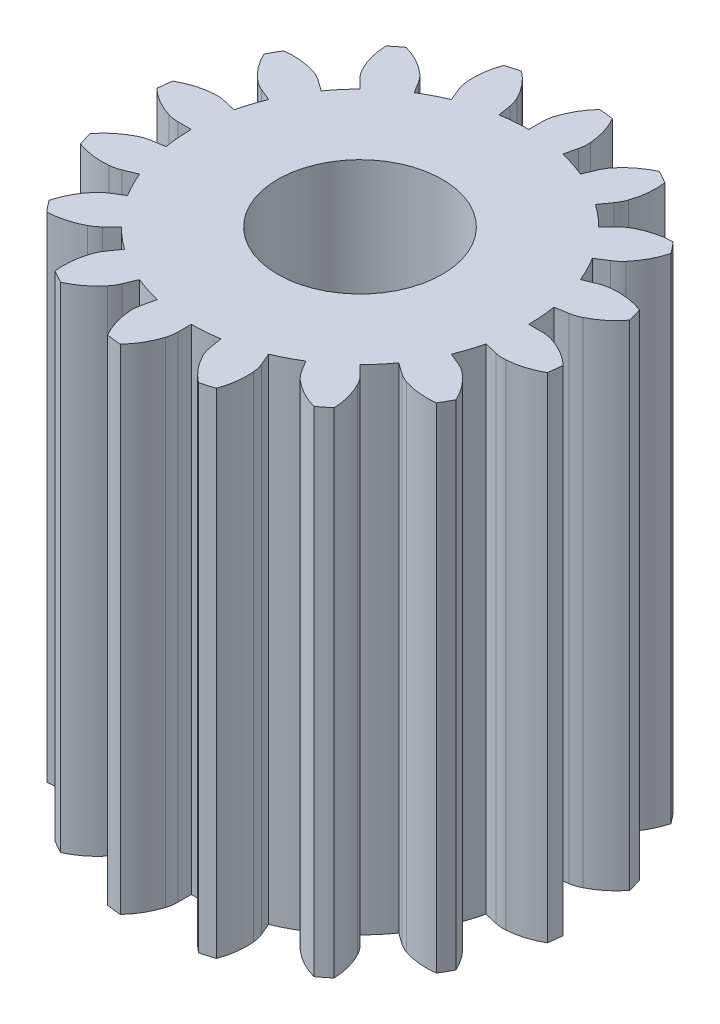
from build123d import *

# Parameters (mm, degrees)
RESSALTO_EXTRUS_O2_DEPTH = 6
PADR_OCIRCULAR1_COUNT    = 16
ESBO_O6_R                = 1
CORTE_EXTRUS_O2_DEPTH    = 6


with BuildPart() as part:
    # Esboço5 → Ressalto-extrusão2 (new body)
    with BuildSketch(Plane(origin=(0, 0, 0), x_dir=(1, 0, 0), z_dir=(0, 1, 0))):
        with BuildLine():
            ThreePointArc((0.513081642, 2.284755025), (0.476160184, 2.484429594), (0.395663043, 2.670852066))
            ThreePointArc((0.395663043, 2.670852066), (0.308851182, 2.682277194), (0.221714504, 2.690881394))
            ThreePointArc((0.221714504, 2.690881394), (0.10095443, 2.527632713), (0.019617773, 2.341574991))
            ThreePointArc((0.019617773, 2.341574991), (0.004932086, 2.277352206), (0, 2.211656619))
            Line((0, 2.211656619), (0, 2.05))
            ThreePointArc((0, 2.05), (-0.23449812, -2.036543796), (0.465917747, 1.996351836))
            Line((0.465917747, 1.996351836), (0.50265857, 2.153777928))
            ThreePointArc((0.50265857, 2.153777928), (0.512786649, 2.218875221), (0.513081642, 2.284755025))
        make_face()
    ressalto_extrus_o2 = extrude(amount=RESSALTO_EXTRUS_O2_DEPTH)

    # PadrãoCircular1: Ressalto-extrusão2 ×16 about axis
    padr_ocircular1_axis = Axis((0, 0, 0), (0, 1, 0))
    for i in range(1, PADR_OCIRCULAR1_COUNT):
        add(ressalto_extrus_o2.rotate(padr_ocircular1_axis, i * 360 / PADR_OCIRCULAR1_COUNT))

    # Esboço6 → Corte-extrusão2 (cut)
    with BuildSketch(Plane(origin=(0, 6, 0), x_dir=(1, 0, 0), z_dir=(0, 1, 0))):
        with Locations(Location((0, 0, 0), (0, 0, 270))):
            Circle(ESBO_O6_R)
    extrude(amount=-CORTE_EXTRUS_O2_DEPTH, mode=Mode.SUBTRACT)


solid = part.part
